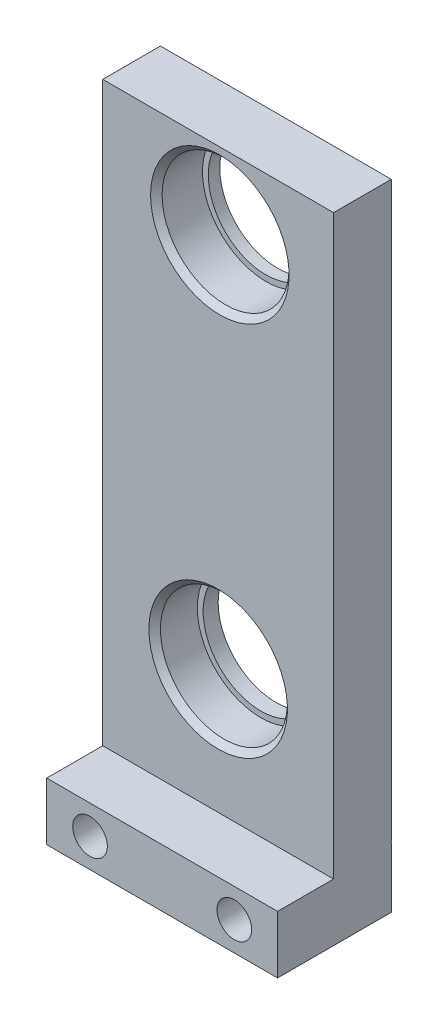
from build123d import *

# Parameters (mm, degrees)
SKIZZE1_W                             = 40
SKIZZE1_H                             = 110
AUFSATZ_LINEAR_AUSTRAGEN1_DEPTH       = 10
SKIZZE2_W                             = 40
SKIZZE2_H                             = 0.1
SCHNITT_LINEAR_AUSTRAGEN1_DEPTH       = 0.1
SKIZZE3_R                             = 11
SCHNITT_LINEAR_AUSTRAGEN2_DEPTH       = 11
SKIZZE5_R                             = 11
SCHNITT_LINEAR_AUSTRAGEN4_DEPTH       = 8
SKIZZE6_R                             = 10
SCHNITT_LINEAR_AUSTRAGEN5_DEPTH       = 8
FASE1_SIZE                            = 1
SKIZZE10_W                            = 40
SKIZZE10_H                            = 10
AUFSATZ_LINEAR_AUSTRAGEN2_DEPTH       = 9.7
SKIZZE11_R                            = 3
SCHNITT_LINEAR_AUSTRAGEN6_DEPTH       = 21
SKIZZE12_R                            = 4.5
SCHNITT_LINEAR_AUSTRAGEN11_DEPTH      = 13
SKIZZE15_R                            = 15.675658378
AUFSATZ_LINEAR_AUSTRAGEN3_DEPTH       = 2.5
SCHNITT_LINEAR_AUSTRAGEN13_DEPTH      = 3
SCHNITT_LINEAR_AUSTRAGEN13_DEPTH_BACK = 15
SKIZZE13_R                            = 10


with BuildPart() as part:
    # Skizze1 → Aufsatz-Linear austragen1 (new body)
    with BuildSketch(Plane.XY):
        with Locations((20, 55)):
            Rectangle(SKIZZE1_W, SKIZZE1_H)
    extrude(amount=AUFSATZ_LINEAR_AUSTRAGEN1_DEPTH)

    # Skizze2 → Schnitt-Linear austragen1 (cut)
    with BuildSketch(Plane(origin=(0, 0, 0), x_dir=(-1, 0, 0), z_dir=(0, 0, -1))):
        with Locations((-20, 10.55)):
            Rectangle(SKIZZE2_W, SKIZZE2_H)
    extrude(amount=-SCHNITT_LINEAR_AUSTRAGEN1_DEPTH, mode=Mode.SUBTRACT)

    # Skizze3 → Schnitt-Linear austragen2 (cut)
    with BuildSketch(Plane(origin=(0, 0, 0.1), x_dir=(-1, 0, 0), z_dir=(0, 0, -1))):
        with Locations((-20, 31.5)):
            Circle(SKIZZE3_R)
    extrude(amount=-SCHNITT_LINEAR_AUSTRAGEN2_DEPTH, mode=Mode.SUBTRACT)

    # Skizze5 → Schnitt-Linear austragen4 (cut)
    with BuildSketch(Plane.XY.offset(10)):
        with Locations((20.290455997, 96.8)):
            Circle(SKIZZE5_R)
    extrude(amount=-SCHNITT_LINEAR_AUSTRAGEN4_DEPTH, mode=Mode.SUBTRACT)

    # Skizze6 → Schnitt-Linear austragen5 (cut)
    with BuildSketch(Plane.XY.offset(2)):
        with Locations((20.290455997, 96.8)):
            Circle(SKIZZE6_R)
    extrude(amount=-SCHNITT_LINEAR_AUSTRAGEN5_DEPTH, mode=Mode.SUBTRACT)

    # Fase1
    fase1_edges = [part.edges().sort_by_distance(p)[0] for p in [
        (31, 31.5, 10),
        (9.290455997, 96.8, 10),
    ]]
    chamfer(fase1_edges, length=FASE1_SIZE)

    # Skizze10 → Aufsatz-Linear austragen2 (add)
    with BuildSketch(Plane.XY.offset(10)):
        with Locations((20, 5)):
            Rectangle(SKIZZE10_W, SKIZZE10_H)
    extrude(amount=AUFSATZ_LINEAR_AUSTRAGEN2_DEPTH)

    # Skizze11 → Schnitt-Linear austragen6 (cut)
    with BuildSketch(Plane(origin=(0, 0, 0), x_dir=(-1, 0, 0), z_dir=(0, 0, -1))):
        with Locations((-32.5, 5)):
            Circle(SKIZZE11_R)
        with Locations((-7.5, 5)):
            Circle(SKIZZE11_R)
    extrude(amount=-SCHNITT_LINEAR_AUSTRAGEN6_DEPTH, mode=Mode.SUBTRACT)

    # Skizze12 → Schnitt-Linear austragen11 (cut)
    with BuildSketch(Plane(origin=(0, 0, 0), x_dir=(-1, 0, 0), z_dir=(0, 0, -1))):
        with Locations((-32.5, 5)):
            Circle(SKIZZE12_R)
        with Locations((-7.5, 5)):
            Circle(SKIZZE12_R)
    extrude(amount=-SCHNITT_LINEAR_AUSTRAGEN11_DEPTH, mode=Mode.SUBTRACT)

    # Skizze15 → Aufsatz-Linear austragen3 (add)
    with BuildSketch(Plane.XY.offset(0.1)):
        with Locations((20, 31.5)):
            Circle(SKIZZE15_R)
    extrude(amount=AUFSATZ_LINEAR_AUSTRAGEN3_DEPTH)

    # Skizze13 → Schnitt-Linear austragen13 (cut, two sides: drawn at the far end of the back side and taken through both)
    with BuildSketch(Plane(origin=(0, 0, 0.1), x_dir=(-1, 0, 0), z_dir=(0, 0, -1)).offset(-SCHNITT_LINEAR_AUSTRAGEN13_DEPTH_BACK)):
        with Locations(Location((-20, 31.5, 0), (0, 0, 180))):
            Circle(SKIZZE13_R)
    extrude(amount=SCHNITT_LINEAR_AUSTRAGEN13_DEPTH + SCHNITT_LINEAR_AUSTRAGEN13_DEPTH_BACK, mode=Mode.SUBTRACT)


solid = part.part
